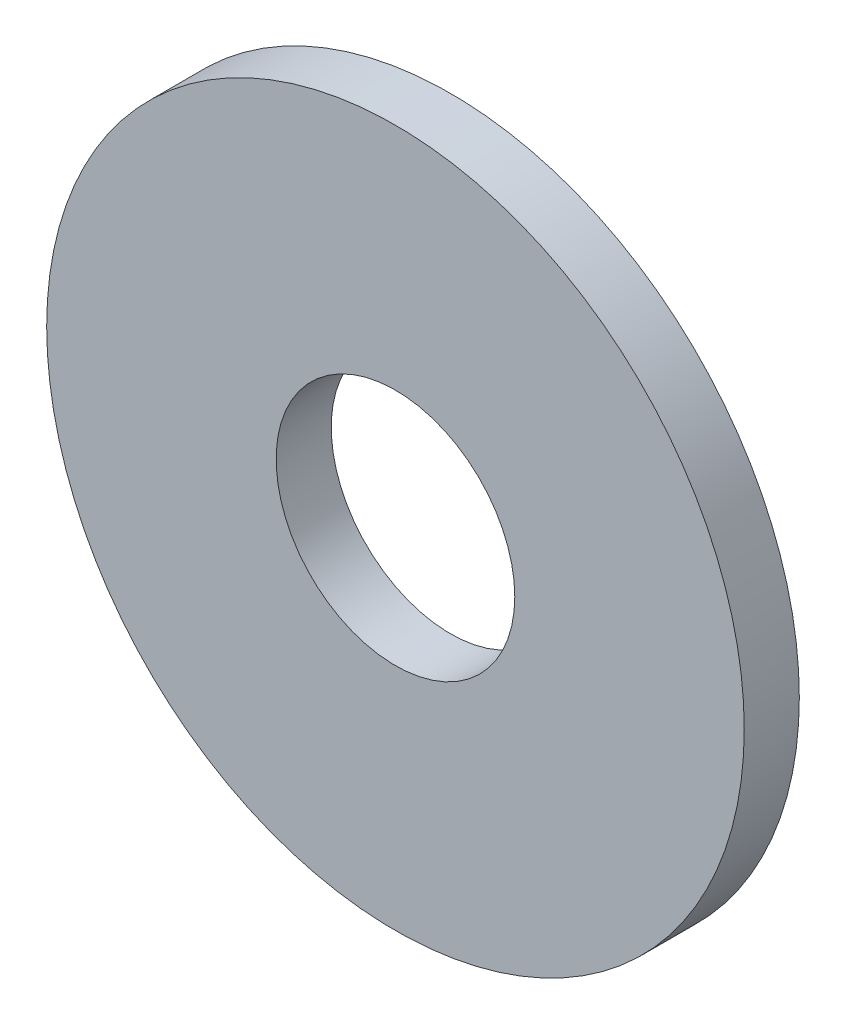
from build123d import *

# Parameters (mm, degrees)
TOP_SKETCH_R            = 1.9
TOP_SKETCH_R_2          = 0.65
EXTRUDE_THICKNESS_DEPTH = 0.3


with BuildPart() as part:
    # Top Sketch → Extrude Thickness (new body)
    with BuildSketch(Plane.XY):
        Circle(TOP_SKETCH_R)
        Circle(TOP_SKETCH_R_2, mode=Mode.SUBTRACT)
    extrude(amount=EXTRUDE_THICKNESS_DEPTH)


solid = part.part
